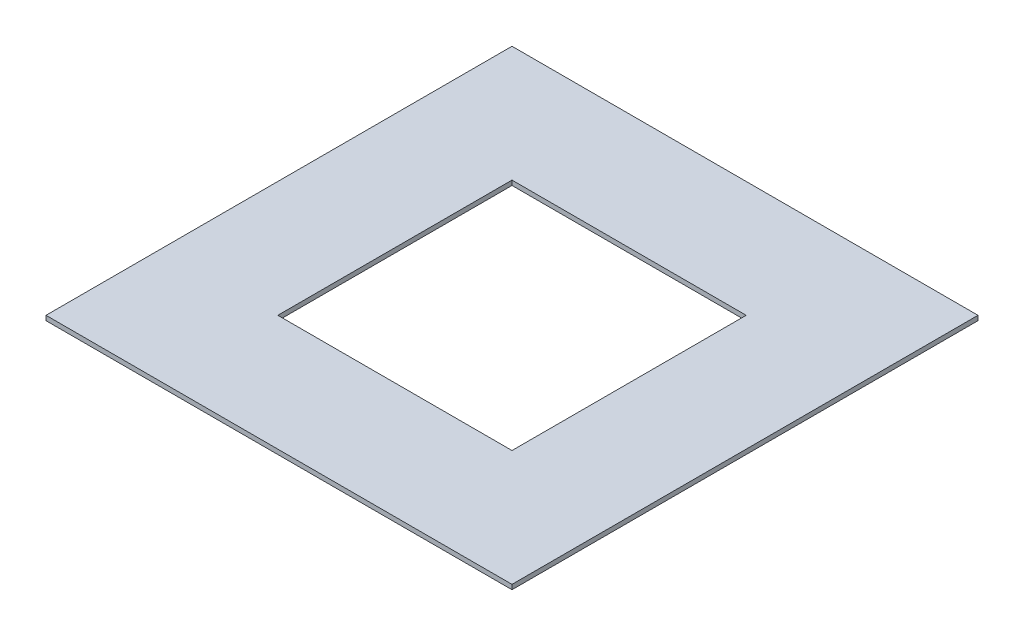
from build123d import *

# Parameters (mm, degrees)
CROQUIS1_W              = 99.5
CROQUIS1_H              = 99.5
CROQUIS1_W_2            = 50
CROQUIS1_H_2            = 50
SALIENTE_EXTRUIR1_DEPTH = 1


with BuildPart() as part:
    # Croquis1 → Saliente-Extruir1 (new body)
    with BuildSketch(Plane(origin=(0, 0, 0), x_dir=(1, 0, 0), z_dir=(0, 1, 0))):
        Rectangle(CROQUIS1_W, CROQUIS1_H)
        Rectangle(CROQUIS1_W_2, CROQUIS1_H_2, mode=Mode.SUBTRACT)
    extrude(amount=SALIENTE_EXTRUIR1_DEPTH)


solid = part.part
